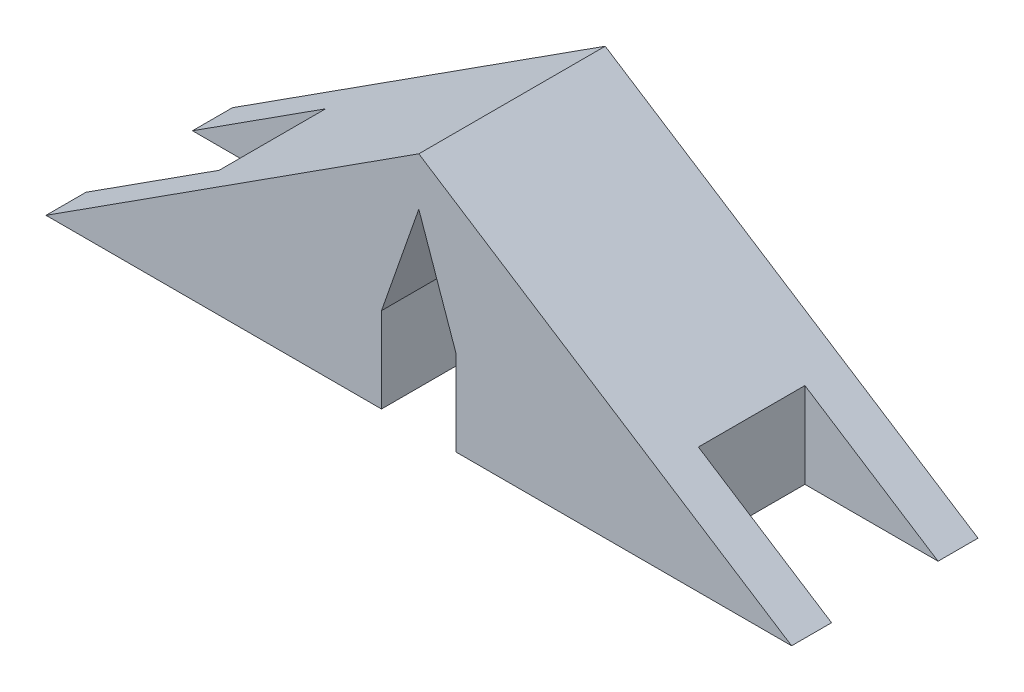
from build123d import *

# Parameters (mm, degrees)
EXTRUDE_1_DEPTH     = 35
SKETCH_2_W          = 25
SKETCH_2_H          = 20
CUT_EXTRUDE_1_DEPTH = 67.895440801


with BuildPart() as part:
    # Эскиз1 → Бобышка-Вытянуть1 (new body)
    with BuildSketch(Plane.XY):
        Polygon((35, 22.5), (-35, -22.5), (28, -22.5), (28, -6.5), (35, 13.5), align=None)
    extrude_1 = extrude(amount=EXTRUDE_1_DEPTH)

    # Эскиз2 → Вырез-Вытянуть1 (cut, through all)
    with BuildSketch(Plane.XZ.offset(22.5)):
        with Locations((-22.5, 17.5)):
            Rectangle(SKETCH_2_W, SKETCH_2_H)
    cut_extrude_1 = extrude(amount=-CUT_EXTRUDE_1_DEPTH, mode=Mode.SUBTRACT)

    # Зеркальное отражение1: Бобышка-Вытянуть1, Вырез-Вытянуть1 across plane
    add(extrude_1.mirror(Plane(origin=(35, 0, 35), x_dir=(0, 0, 1), z_dir=(-1, 0, 0))))
    add(cut_extrude_1.mirror(Plane(origin=(35, 0, 35), x_dir=(0, 0, 1), z_dir=(-1, 0, 0))), mode=Mode.SUBTRACT)


solid = part.part
